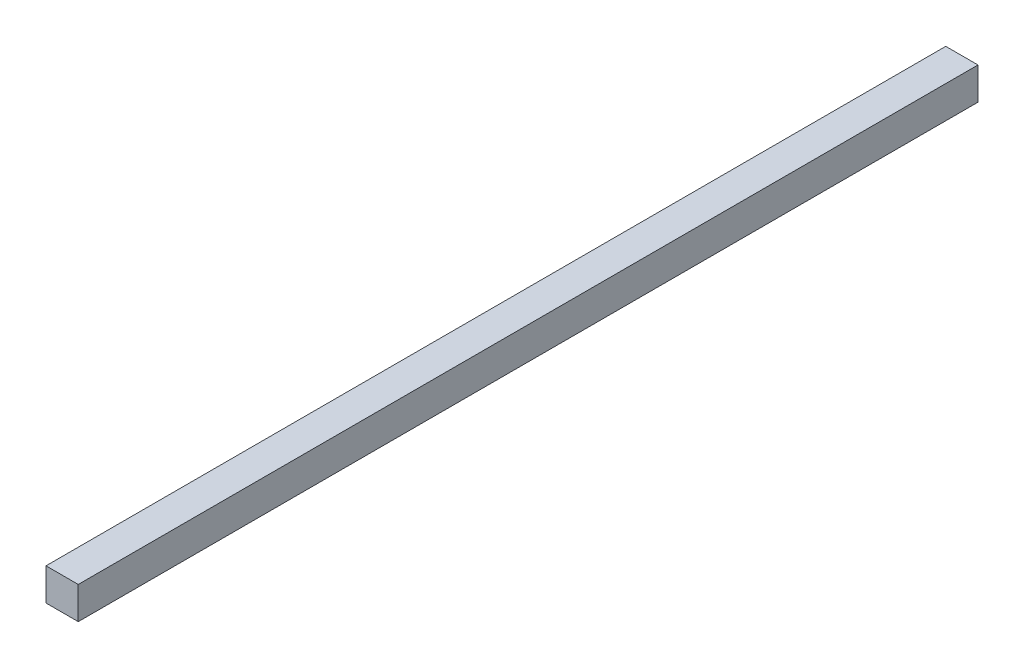
from build123d import *

# Parameters (mm, degrees)
SKETCH1_W           = 2
SKETCH1_H           = 2
BOSS_EXTRUDE1_DEPTH = 55.8


with BuildPart() as part:
    # Sketch1 → Boss-Extrude1 (new body)
    with BuildSketch(Plane.XY):
        Rectangle(SKETCH1_W, SKETCH1_H)
    extrude(amount=BOSS_EXTRUDE1_DEPTH)


solid = part.part
